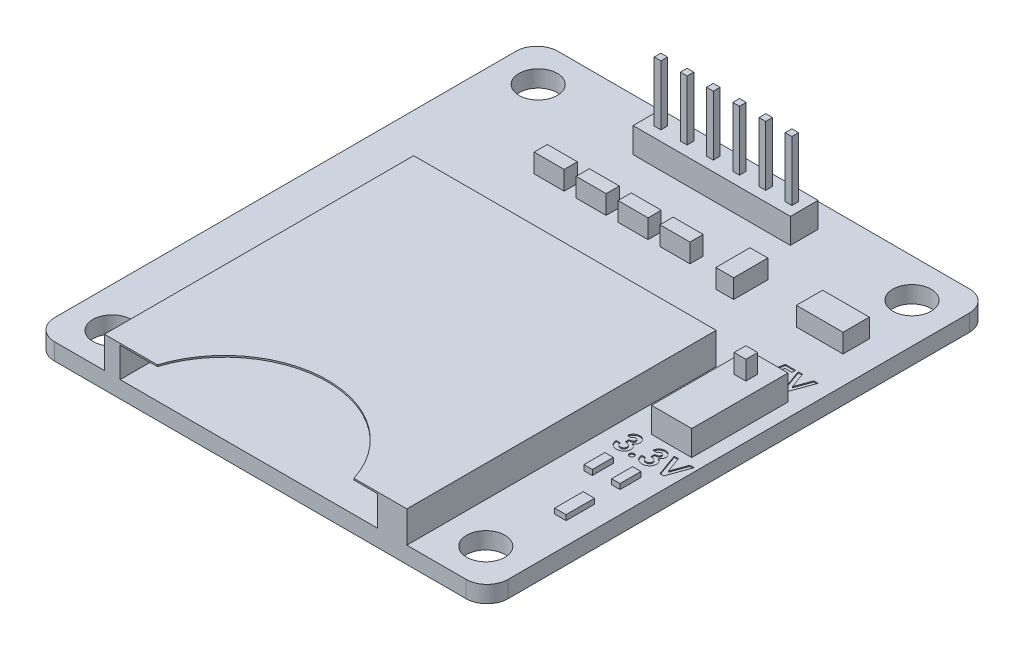
from build123d import *

# Parameters (mm, degrees)
SKETCH1_W                 = 43.25
SKETCH1_H                 = 48
SKETCH1_R                 = 1.825
BOSS_EXTRUDE1_DEPTH       = 1.6
BOSS_EXTRUDE2_DEPTH       = 3
SKETCH3_W                 = 24.55
SKETCH3_H                 = 2.85
CUT_EXTRUDE1_DEPTH        = 21.6
SKETCH4_W                 = 2.86
SKETCH4_H                 = 1.26
SKETCH4_W_2               = 1.7
SKETCH4_H_2               = 3.26
SKETCH4_W_3               = 4.45
SKETCH4_H_3               = 2.5
BOSS_EXTRUDE3_DEPTH       = 1.8
SKETCH4_3_W               = 1.083668594
SKETCH4_3_H               = 2.715833983
SALIENTE_EXTRUIR1_DEPTH   = 0.5
SKETCH4_3_W_2             = 0.8
SKETCH4_3_H_2             = 2
SALIENTE_EXTRUIR1_2_DEPTH = 0.5
SALIENTE_EXTRUIR1_3_DEPTH = 0.5
SKETCH5_W                 = 15
SKETCH5_H                 = 2.65
SKETCH5_W_2               = 3.84
SKETCH5_H_2               = 9.18
BOSS_EXTRUDE4_DEPTH       = 2.4
SKETCH6_W                 = 0.64
SKETCH6_H                 = 0.64
BOSS_EXTRUDE5_DEPTH       = 5.7
SKETCH7_W                 = 1.124823536
SKETCH7_H                 = 1.124823536
BOSS_EXTRUDE6_DEPTH       = 1.8
FILLET1_R                 = 2
CORTAR_EXTRUIR1_DEPTH     = 0.1
CORTAR_EXTRUIR2_DEPTH     = 0.1


with BuildPart() as part:
    # Sketch1 → Boss-Extrude1 (new body)
    with BuildSketch(Plane(origin=(0, 0, 0), x_dir=(1, 0, 0), z_dir=(0, 1, 0))):
        with Locations((21.625, 24)):
            Rectangle(SKETCH1_W, SKETCH1_H)
        with Locations(Location((3.8, 44.325, 0), (0, 0, 270))):
            Circle(SKETCH1_R, mode=Mode.SUBTRACT)
        with Locations(Location((3.8, 3.675, 0), (0, 0, 270))):
            Circle(SKETCH1_R, mode=Mode.SUBTRACT)
        with Locations(Location((39.45, 44.325, 0), (0, 0, 270))):
            Circle(SKETCH1_R, mode=Mode.SUBTRACT)
        with Locations(Location((39.45, 3.675, 0), (0, 0, 270))):
            Circle(SKETCH1_R, mode=Mode.SUBTRACT)
    extrude(amount=BOSS_EXTRUDE1_DEPTH)

    # Sketch2 → Boss-Extrude2 (add)
    with BuildSketch(Plane(origin=(0, 1.6, 0), x_dir=(1, 0, 0), z_dir=(0, 1, 0))):
        with BuildLine():
            Line((6.75, 0), (11.8, 0))
            ThreePointArc((11.8, 0), (21.175, 6.86), (30.55, 0))
            Line((30.55, 0), (35.6, 0))
            Line((35.6, 0), (35.6, 29.5))
            Line((35.6, 29.5), (6.75, 29.5))
            Line((6.75, 29.5), (6.75, 0))
        make_face()
    extrude(amount=BOSS_EXTRUDE2_DEPTH)

    # Sketch3 → Cut-Extrude1 (cut)
    with BuildSketch(Plane.XY):
        with Locations((20.525, 3.025)):
            Rectangle(SKETCH3_W, SKETCH3_H)
    extrude(amount=-CUT_EXTRUDE1_DEPTH, mode=Mode.SUBTRACT)

    # Sketch4 → Boss-Extrude3 (add)
    with BuildSketch(Plane(origin=(0, 1.6, 0), x_dir=(1, 0, 0), z_dir=(0, 1, 0))):
        with Locations((12.43, 37.37)):
            Rectangle(SKETCH4_W, SKETCH4_H)
        with Locations((16.43, 37.37)):
            Rectangle(SKETCH4_W, SKETCH4_H)
        with Locations((20.43, 37.37)):
            Rectangle(SKETCH4_W, SKETCH4_H)
        with Locations((24.43, 37.37)):
            Rectangle(SKETCH4_W, SKETCH4_H)
        with Locations((30.042643512, 37.503476501)):
            Rectangle(SKETCH4_W_2, SKETCH4_H_2)
        with Locations((38.38701225, 37.841656457)):
            Rectangle(SKETCH4_W_3, SKETCH4_H_3)
    extrude(amount=BOSS_EXTRUDE3_DEPTH)

    # Sketch5 → Boss-Extrude4 (add)
    with BuildSketch(Plane(origin=(0, 1.6, 0), x_dir=(1, 0, 0), z_dir=(0, 1, 0))):
        with Locations((21.625, 44.375)):
            Rectangle(SKETCH5_W, SKETCH5_H)
        with Locations((40.03, 25.41)):
            Rectangle(SKETCH5_W_2, SKETCH5_H_2)
    extrude(amount=BOSS_EXTRUDE4_DEPTH)

    # Sketch6 → Boss-Extrude5 (add)
    with BuildSketch(Plane(origin=(0, 4, 0), x_dir=(1, 0, 0), z_dir=(0, 1, 0))):
        with Locations((15.485, 44.34)):
            Rectangle(SKETCH6_W, SKETCH6_H)
        with Locations((17.985, 44.34)):
            Rectangle(SKETCH6_W, SKETCH6_H)
        with Locations((20.485, 44.34)):
            Rectangle(SKETCH6_W, SKETCH6_H)
        with Locations((22.985, 44.34)):
            Rectangle(SKETCH6_W, SKETCH6_H)
        with Locations((25.485, 44.34)):
            Rectangle(SKETCH6_W, SKETCH6_H)
        with Locations((27.985, 44.34)):
            Rectangle(SKETCH6_W, SKETCH6_H)
    extrude(amount=BOSS_EXTRUDE5_DEPTH)

    # Sketch7 → Boss-Extrude6 (add)
    with BuildSketch(Plane(origin=(0, 4, 0), x_dir=(1, 0, 0), z_dir=(0, 1, 0))):
        with Locations((40.050520736, 27.882411768)):
            Rectangle(SKETCH7_W, SKETCH7_H)
    extrude(amount=BOSS_EXTRUDE6_DEPTH)

    # Fillet1
    fillet1_edges = [part.edges().sort_by_distance(p)[0] for p in [
        (0, 0.8, 0),
        (43.25, 0.8, 0),
        (43.25, 0.8, -48),
        (0, 0.8, -48),
    ]]
    fillet(fillet1_edges, radius=FILLET1_R)

    # Croquis1 → Cortar-Extruir1 (cut)
    with BuildSketch(Plane(origin=(0, 1.6, 0), x_dir=(1, 0, 0), z_dir=(0, 1, 0))):
        with BuildLine():
            Line((38.71891942, 32.985440886), (39.682698133, 32.985440886))
            Line((39.682698133, 32.985440886), (39.682698133, 32.632663108))
            Line((39.682698133, 32.632663108), (39.019967764, 32.632663108))
            Line((39.019967764, 32.632663108), (38.937285472, 32.232396014))
            add(Edge.make_bspline(
                [(38.937285472, 32.232396014), (38.948552118, 32.235533917), (38.970772259, 32.241722507), (39.004246928, 32.247928879), (39.036688547, 32.251951652), (39.05797654, 32.252488237), (39.068305104, 32.252748578)],
                knots=[0, 0, 0, 0, 1.05461699, 2.079921384, 3.068411212, 4, 4, 4, 4], degree=3))
            add(Edge.make_bspline(
                [(39.068305104, 32.252748578), (39.090812127, 32.252232843), (39.135178428, 32.251216215), (39.200080697, 32.241565098), (39.262228453, 32.226364882), (39.321431518, 32.204686238), (39.377632058, 32.176470923), (39.4308982, 32.1423383), (39.481295318, 32.102228422), (39.527928147, 32.056116175), (39.570776339, 32.005483884), (39.608030398, 31.950719704), (39.639847689, 31.892604519), (39.665154063, 31.830777086), (39.68512801, 31.765625722), (39.69956163, 31.697108677), (39.708096951, 31.625144749), (39.709247887, 31.576048906), (39.709834885, 31.551009128)],
                knots=[0, 0, 0, 0, 1.01440847, 1.999622559, 2.951875003, 3.895578053, 4.836219714, 5.782137149, 6.743708247, 7.735272588, 8.734977101, 9.730283169, 10.717124674, 11.717316708, 12.737475749, 13.78628267, 14.87096371, 16, 16, 16, 16], degree=3))
            add(Edge.make_bspline(
                [(39.709834885, 31.551009128), (39.709117564, 31.525685092), (39.707702079, 31.475713365), (39.698467339, 31.40223725), (39.682167858, 31.331863719), (39.65977889, 31.264404385), (39.630282857, 31.200355056), (39.594809841, 31.139052231), (39.552760089, 31.080950939), (39.504546252, 31.02664679), (39.452131486, 30.977011755), (39.396322134, 30.93334772), (39.337510273, 30.896604788), (39.275694483, 30.866910288), (39.211229422, 30.843416527), (39.144095523, 30.826314191), (39.073966525, 30.816506952), (39.026358047, 30.815176809), (39.002159271, 30.814500715)],
                knots=[0, 0, 0, 0, 1.06808661, 2.107647099, 3.116961351, 4.110378221, 5.100014249, 6.085620622, 7.093190682, 8.119403071, 9.144090782, 10.133780668, 11.103064255, 12.062861538, 13.020824475, 13.992378307, 14.979551724, 16, 16, 16, 16], degree=3))
            add(Edge.make_bspline(
                [(39.002159271, 30.814500715), (38.980519025, 30.815053802), (38.937839931, 30.816144606), (38.874975501, 30.822849261), (38.814367208, 30.834703154), (38.756336819, 30.851858806), (38.700273754, 30.872973498), (38.646826121, 30.89938141), (38.595700214, 30.930579701), (38.547041212, 30.965999), (38.501639755, 31.005897467), (38.460202116, 31.049573213), (38.422477426, 31.096475727), (38.389272934, 31.147183644), (38.360692727, 31.201622045), (38.335347216, 31.259149362), (38.314601662, 31.320366362), (38.30407389, 31.362805388), (38.298723774, 31.38437251)],
                knots=[0, 0, 0, 0, 1.054957082, 2.080596141, 3.077793124, 4.061112343, 5.027190972, 5.994718051, 6.962465889, 7.943658696, 8.924948258, 9.904494768, 10.875059, 11.855380583, 12.854004648, 13.869083016, 14.917087635, 16, 16, 16, 16], degree=3))
            Line((38.298723774, 31.38437251), (38.732911808, 31.38437251))
            add(Edge.make_bspline(
                [(38.732911808, 31.38437251), (38.740848776, 31.369427373), (38.756273367, 31.340383204), (38.785614349, 31.301822707), (38.818459716, 31.268939971), (38.854513184, 31.241413726), (38.894008358, 31.220791531), (38.935335884, 31.205152613), (38.979014942, 31.196115461), (39.008762309, 31.194985728), (39.02378387, 31.194415245)],
                knots=[0, 0, 0, 0, 1.104910296, 2.147267069, 3.153527244, 4.136738762, 5.099945312, 6.05603338, 7.018353, 8, 8, 8, 8], degree=3))
            add(Edge.make_bspline(
                [(39.02378387, 31.194415245), (39.034253697, 31.194809168), (39.054853257, 31.195584219), (39.085203451, 31.199684432), (39.114174046, 31.207450144), (39.141980429, 31.218203849), (39.168697296, 31.231614934), (39.193941652, 31.248545554), (39.218152702, 31.268033327), (39.240961857, 31.290395611), (39.261620377, 31.315324357), (39.279735639, 31.342111994), (39.295933181, 31.370163294), (39.307930949, 31.400589441), (39.317756105, 31.432481899), (39.324991748, 31.466081242), (39.329315861, 31.501426711), (39.329716158, 31.525556073), (39.329920355, 31.537864764)],
                knots=[0, 0, 0, 0, 0.978869489, 1.925942215, 2.855067702, 3.774946051, 4.70828698, 5.642468714, 6.60995405, 7.609372294, 8.622401667, 9.629904756, 10.629323, 11.642352373, 12.678539694, 13.745912462, 14.850161547, 16, 16, 16, 16], degree=3))
            add(Edge.make_bspline(
                [(39.329920355, 31.537864764), (39.329683361, 31.549887743), (39.329222047, 31.573290762), (39.325405964, 31.607654778), (39.318579064, 31.64026001), (39.309277356, 31.67135619), (39.297370058, 31.700754486), (39.282818544, 31.728629892), (39.265560648, 31.754841508), (39.245503717, 31.778855691), (39.224115212, 31.800882182), (39.201137085, 31.820146376), (39.176776357, 31.83613432), (39.151790006, 31.850092259), (39.125180669, 31.860250544), (39.097546682, 31.867246179), (39.068917106, 31.872379295), (39.049389494, 31.872680885), (39.039472305, 31.872834048)],
                knots=[0, 0, 0, 0, 1.166249705, 2.270133367, 3.348514167, 4.393962215, 5.415026464, 6.420877785, 7.440098956, 8.453121383, 9.451844239, 10.415694839, 11.355045125, 12.27538808, 13.187007209, 14.108269027, 15.039275622, 16, 16, 16, 16], degree=3))
            add(Edge.make_bspline(
                [(39.039472305, 31.872834048), (39.028699933, 31.872425296), (39.007109788, 31.87160607), (38.975032237, 31.864940247), (38.943341452, 31.854152444), (38.9118612, 31.83926896), (38.880903976, 31.819791176), (38.849652805, 31.796945968), (38.81915373, 31.769073416), (38.79976157, 31.748313876), (38.789729383, 31.737574299)],
                knots=[0, 0, 0, 0, 0.88288272, 1.769486374, 2.674910571, 3.623812639, 4.617874466, 5.670434592, 6.794841017, 8, 8, 8, 8], degree=3))
            Line((38.789729383, 31.737574299), (38.470024522, 31.810928332))
            Line((38.470024522, 31.810928332), (38.71891942, 32.985440886))
        make_face()
        Polygon((39.940497278, 32.985440886), (40.346276525, 32.985440886), (40.890283603, 31.481895213), (41.435562716, 32.985440886), (41.840069928, 32.985440886), (41.072608656, 30.868774219), (40.706686514, 30.868774219), align=None)
    extrude(amount=-CORTAR_EXTRUIR1_DEPTH, mode=Mode.SUBTRACT)

    # Croquis2 → Cortar-Extruir2 (cut)
    with BuildSketch(Plane(origin=(0, 1.6, 0), x_dir=(1, 0, 0), z_dir=(0, 1, 0))):
        with BuildLine():
            Line((37.428117875, 19.578143636), (37.048203345, 19.578143636))
            add(Edge.make_bspline(
                [(37.048203345, 19.578143636), (37.050885686, 19.597134208), (37.056144238, 19.634363967), (37.06872725, 19.688263383), (37.08377789, 19.739390667), (37.102567844, 19.787583911), (37.124605405, 19.832928962), (37.149666473, 19.875581423), (37.178021968, 19.91535822), (37.199756756, 19.939319921), (37.210599846, 19.951273978)],
                knots=[0, 0, 0, 0, 1.111473889, 2.178970933, 3.205615836, 4.199322666, 5.174200091, 6.12565194, 7.064921805, 8, 8, 8, 8], degree=3))
            add(Edge.make_bspline(
                [(37.210599846, 19.951273978), (37.226239568, 19.96704649), (37.257063815, 19.998132454), (37.308574748, 20.037950141), (37.362567719, 20.07240964), (37.420125579, 20.09972938), (37.480352687, 20.121841545), (37.543727988, 20.136694336), (37.609992508, 20.146549295), (37.655209706, 20.147520042), (37.678284809, 20.148015431)],
                knots=[0, 0, 0, 0, 1.01925491, 2.00884431, 2.983262333, 3.955970413, 4.92937149, 5.924503185, 6.940838805, 8, 8, 8, 8], degree=3))
            add(Edge.make_bspline(
                [(37.678284809, 20.148015431), (37.698799763, 20.147531113), (37.739128027, 20.146579042), (37.798400429, 20.13893633), (37.854911705, 20.125531865), (37.909259193, 20.108005827), (37.960643621, 20.084158723), (38.010199092, 20.056477312), (38.056541025, 20.02252491), (38.099777851, 19.984162114), (38.139499122, 19.942668993), (38.173897917, 19.89831626), (38.203471178, 19.852288678), (38.227835634, 19.804203844), (38.246568589, 19.753980393), (38.259569816, 19.70190846), (38.268079434, 19.648102945), (38.268927214, 19.611532061), (38.269357191, 19.592984048)],
                knots=[0, 0, 0, 0, 1.091422571, 2.145516843, 3.172569842, 4.178562979, 5.178154469, 6.181868002, 7.194278174, 8.227918432, 9.254613415, 10.245994977, 11.209837596, 12.161663635, 13.10878368, 14.055455738, 15.013766427, 16, 16, 16, 16], degree=3))
            add(Edge.make_bspline(
                [(38.269357191, 19.592984048), (38.268474853, 19.570013877), (38.266737799, 19.524792674), (38.252484018, 19.458608083), (38.230172973, 19.395323803), (38.197942499, 19.335825276), (38.157646198, 19.280274424), (38.108203986, 19.230528478), (38.051024106, 19.18580749), (38.008098409, 19.161774426), (37.986117341, 19.149467755)],
                knots=[0, 0, 0, 0, 0.992805628, 1.954529043, 2.915727527, 3.886831945, 4.871318353, 5.87440735, 6.911542536, 8, 8, 8, 8], degree=3))
            add(Edge.make_bspline(
                [(37.986117341, 19.149467755), (38.001204809, 19.144514222), (38.030851006, 19.134780751), (38.072989511, 19.11561079), (38.113058414, 19.094661201), (38.150367743, 19.070323301), (38.185288585, 19.043581206), (38.217608057, 19.014206316), (38.247519262, 18.982262682), (38.274533911, 18.947574626), (38.298510467, 18.910696915), (38.320023354, 18.872481404), (38.337729659, 18.832348546), (38.352729104, 18.790756687), (38.364148828, 18.74733202), (38.372189333, 18.702242813), (38.376836943, 18.655591916), (38.377545783, 18.623985962), (38.3779042, 18.608004747)],
                knots=[0, 0, 0, 0, 1.059543567, 2.081955587, 3.086750234, 4.076226789, 5.052108497, 6.020845489, 6.989030705, 7.970690546, 8.952259656, 9.923888338, 10.895517021, 11.877585046, 12.873342345, 13.889638361, 14.932918083, 16, 16, 16, 16], degree=3))
            add(Edge.make_bspline(
                [(38.3779042, 18.608004747), (38.37717764, 18.584518851), (38.375745012, 18.538209445), (38.366637032, 18.470000431), (38.349679613, 18.404969195), (38.327371191, 18.342367456), (38.297614176, 18.28300338), (38.262595172, 18.225514641), (38.21954978, 18.171894934), (38.171712218, 18.120726692), (38.118585817, 18.074206818), (38.060988155, 18.033876181), (38.000185756, 17.999265318), (37.935793941, 17.971167233), (37.867835079, 17.949528495), (37.796460646, 17.933887017), (37.721370746, 17.924317302), (37.670116014, 17.923314099), (37.643939857, 17.922801756)],
                knots=[0, 0, 0, 0, 1.005138573, 1.981928558, 2.936866704, 3.876260664, 4.820238198, 5.773547, 6.751179199, 7.756627054, 8.768222608, 9.766606018, 10.760583154, 11.757261445, 12.767156078, 13.807575856, 14.880313354, 16, 16, 16, 16], degree=3))
            add(Edge.make_bspline(
                [(37.643939857, 17.922801756), (37.619177635, 17.923341935), (37.570758385, 17.924398184), (37.4999351, 17.933540552), (37.432624271, 17.948287933), (37.36865412, 17.96907559), (37.308272143, 17.996033628), (37.250930772, 18.028134603), (37.197774241, 18.067230024), (37.148210283, 18.11155505), (37.103338376, 18.161285213), (37.063233458, 18.215268537), (37.028779849, 18.2737103), (36.999836256, 18.336360813), (36.976628951, 18.403329986), (36.958323097, 18.474481631), (36.945536159, 18.549954759), (36.94164187, 18.601881876), (36.939656337, 18.628357312)],
                knots=[0, 0, 0, 0, 1.066544725, 2.085487077, 3.070979577, 4.031932826, 4.977951092, 5.916076795, 6.857635327, 7.814973522, 8.776389752, 9.738577119, 10.707772778, 11.69409279, 12.707140348, 13.757286496, 14.856535458, 16, 16, 16, 16], degree=3))
            Line((36.939656337, 18.628357312), (37.319570867, 18.628357312))
            add(Edge.make_bspline(
                [(37.319570867, 18.628357312), (37.321978345, 18.615045115), (37.326667542, 18.589116121), (37.335813531, 18.551576702), (37.347732032, 18.516925499), (37.361512784, 18.484854534), (37.376398071, 18.454942727), (37.394383057, 18.428294793), (37.414149897, 18.404187133), (37.442673591, 18.375527681), (37.483450176, 18.346081291), (37.538512076, 18.320490977), (37.599763225, 18.305491908), (37.642583886, 18.303662068), (37.664716433, 18.302716286)],
                knots=[0, 0, 0, 0, 0.928156231, 1.807827665, 2.648129825, 3.438902246, 4.202261636, 4.936546065, 5.639352463, 6.338805438, 7.70633318, 9.064371875, 10.482673459, 12, 12, 12, 12], degree=3))
            add(Edge.make_bspline(
                [(37.664716433, 18.302716286), (37.676460744, 18.302917681), (37.699465223, 18.30331217), (37.733255378, 18.307684548), (37.765445257, 18.314885858), (37.796094817, 18.324672171), (37.825399175, 18.336939926), (37.852798442, 18.352758462), (37.878851083, 18.371149769), (37.903273881, 18.39182648), (37.925841051, 18.414356694), (37.944618263, 18.439305077), (37.961779276, 18.464657094), (37.974471685, 18.492071362), (37.98559297, 18.520072702), (37.992399764, 18.549677473), (37.997539383, 18.580264647), (37.997838077, 18.601197167), (37.99798967, 18.611820853)],
                knots=[0, 0, 0, 0, 1.110435564, 2.175094844, 3.216326037, 4.226890168, 5.215276772, 6.21526065, 7.213097102, 8.228249917, 9.239874822, 10.221364777, 11.178138315, 12.128914389, 13.072518965, 14.022636769, 14.996447288, 16, 16, 16, 16], degree=3))
            add(Edge.make_bspline(
                [(37.99798967, 18.611820853), (37.997587218, 18.623439664), (37.996786028, 18.646570055), (37.990240224, 18.680323996), (37.979903014, 18.712792567), (37.965543368, 18.743831981), (37.946367661, 18.773327835), (37.923740541, 18.801871903), (37.895879364, 18.827978518), (37.865311922, 18.853784115), (37.829865698, 18.876278813), (37.791266972, 18.897038115), (37.74850131, 18.91355611), (37.702612661, 18.928309739), (37.652732997, 18.93908556), (37.599172052, 18.946909857), (37.542016229, 18.952733833), (37.502617977, 18.953569378), (37.482391379, 18.953998337)],
                knots=[0, 0, 0, 0, 0.809814727, 1.612155564, 2.388397, 3.182215007, 3.988903953, 4.837162975, 5.715530372, 6.646997145, 7.623086902, 8.637258368, 9.698941581, 10.815059213, 11.996518529, 13.252603015, 14.589518788, 16, 16, 16, 16], degree=3))
            Line((37.482391379, 18.953998337), (37.482391379, 19.306776115))
            add(Edge.make_bspline(
                [(37.482391379, 19.306776115), (37.507574697, 19.308920807), (37.554687696, 19.312933101), (37.620083065, 19.322315989), (37.675137536, 19.334857764), (37.721174344, 19.349988737), (37.759400359, 19.369420849), (37.792794395, 19.390873041), (37.821554919, 19.415786628), (37.845861419, 19.443418689), (37.865305864, 19.473092932), (37.879067508, 19.50434813), (37.88815498, 19.536217209), (37.889016017, 19.558014699), (37.889442662, 19.568815378)],
                knots=[0, 0, 0, 0, 1.70044513, 3.18119609, 4.440695891, 5.496282586, 6.431922213, 7.318171381, 8.16090191, 8.983045123, 9.787564368, 10.536848927, 11.275007137, 12, 12, 12, 12], degree=3))
            add(Edge.make_bspline(
                [(37.889442662, 19.568815378), (37.888706577, 19.582595871), (37.887269896, 19.609492476), (37.876111853, 19.647987185), (37.856742755, 19.682302026), (37.830772195, 19.712364794), (37.799126165, 19.73747547), (37.76203147, 19.755705393), (37.720293068, 19.766416287), (37.690927853, 19.767526645), (37.675740738, 19.768100901)],
                knots=[0, 0, 0, 0, 1.009664648, 1.970651636, 2.907870547, 3.878035693, 4.867062054, 5.849714035, 6.887914197, 8, 8, 8, 8], degree=3))
            add(Edge.make_bspline(
                [(37.675740738, 19.768100901), (37.661975327, 19.76742334), (37.634660534, 19.76607885), (37.594718131, 19.756043937), (37.556786156, 19.739151409), (37.521650073, 19.715857608), (37.489817078, 19.687882741), (37.463691373, 19.654752318), (37.44196125, 19.61845124), (37.432750423, 19.591632176), (37.428117875, 19.578143636)],
                knots=[0, 0, 0, 0, 0.98818071, 1.960853194, 2.938124878, 3.957524365, 4.978590984, 5.968022688, 6.978025184, 8, 8, 8, 8], degree=3))
        make_face()
        with BuildLine():
            add(Edge.make_bspline(
                [(38.879934115, 18.411263294), (38.895270814, 18.41042242), (38.925466125, 18.408766884), (38.969094234, 18.396411789), (39.008468853, 18.3742141), (39.043675024, 18.345261063), (39.073444475, 18.310426694), (39.094961161, 18.270702355), (39.108360141, 18.227242352), (39.109839398, 18.196952042), (39.110596508, 18.181448925)],
                knots=[0, 0, 0, 0, 1.016957001, 2.002212695, 2.9757545, 3.99499976, 5.013036768, 5.994806404, 6.97370641, 8, 8, 8, 8], degree=3))
            add(Edge.make_bspline(
                [(39.110596508, 18.181448925), (39.109844358, 18.165943318), (39.108374791, 18.135648143), (39.094868441, 18.092103455), (39.073476628, 18.052052618), (39.043672635, 18.016844976), (39.008614654, 17.987346292), (38.969003705, 17.965353298), (38.925549236, 17.95229733), (38.895285442, 17.950732347), (38.879934115, 17.949938508)],
                knots=[0, 0, 0, 0, 1.023218912, 1.999186227, 2.986238111, 4.008388923, 5.030539734, 6.0011649, 6.986089706, 8, 8, 8, 8], degree=3))
            add(Edge.make_bspline(
                [(38.879934115, 17.949938508), (38.86457915, 17.950725892), (38.834308184, 17.952278149), (38.790786169, 17.965463347), (38.750882781, 17.987199458), (38.715815991, 18.016880758), (38.685878848, 18.051927945), (38.665095223, 18.092229823), (38.651463065, 18.135631726), (38.650013589, 18.16593776), (38.649271721, 18.181448925)],
                knots=[0, 0, 0, 0, 1.013427518, 1.99788335, 2.976245624, 3.997909735, 5.019573847, 6.001765691, 6.977268297, 8, 8, 8, 8], degree=3))
            add(Edge.make_bspline(
                [(38.649271721, 18.181448925), (38.650018483, 18.196957696), (38.651477522, 18.227259054), (38.665002768, 18.270574532), (38.685912157, 18.310552045), (38.715813495, 18.345225207), (38.751029333, 18.374359788), (38.790695132, 18.396303248), (38.834391253, 18.408786207), (38.864593761, 18.410428929), (38.879934115, 18.411263294)],
                knots=[0, 0, 0, 0, 1.025808215, 2.00424526, 2.981110158, 3.998665696, 5.017428914, 5.998734231, 6.983523959, 8, 8, 8, 8], degree=3))
        make_face()
        with BuildLine():
            Line((39.870425568, 19.578143636), (39.490511038, 19.578143636))
            add(Edge.make_bspline(
                [(39.490511038, 19.578143636), (39.493193379, 19.597134208), (39.498451931, 19.634363967), (39.511034942, 19.688263383), (39.526085582, 19.739390667), (39.544875537, 19.787583911), (39.566913097, 19.832928962), (39.591974165, 19.875581423), (39.62032966, 19.91535822), (39.642064448, 19.939319921), (39.652907539, 19.951273978)],
                knots=[0, 0, 0, 0, 1.111473889, 2.178970933, 3.205615836, 4.199322666, 5.174200091, 6.12565194, 7.064921805, 8, 8, 8, 8], degree=3))
            add(Edge.make_bspline(
                [(39.652907539, 19.951273978), (39.66854726, 19.96704649), (39.699371508, 19.998132454), (39.750882441, 20.037950141), (39.804875411, 20.07240964), (39.862433272, 20.09972938), (39.922660379, 20.121841545), (39.98603568, 20.136694336), (40.0523002, 20.146549295), (40.097517399, 20.147520042), (40.120592501, 20.148015431)],
                knots=[0, 0, 0, 0, 1.01925491, 2.00884431, 2.983262333, 3.955970413, 4.92937149, 5.924503185, 6.940838805, 8, 8, 8, 8], degree=3))
            add(Edge.make_bspline(
                [(40.120592501, 20.148015431), (40.141107455, 20.147531113), (40.18143572, 20.146579042), (40.240708122, 20.13893633), (40.297219397, 20.125531865), (40.351566886, 20.108005827), (40.402951313, 20.084158723), (40.452506785, 20.056477312), (40.498848718, 20.02252491), (40.542085544, 19.984162114), (40.581806815, 19.942668993), (40.616205609, 19.89831626), (40.64577887, 19.852288678), (40.670143326, 19.804203844), (40.688876281, 19.753980393), (40.701877508, 19.70190846), (40.710387126, 19.648102945), (40.711234907, 19.611532061), (40.711664884, 19.592984048)],
                knots=[0, 0, 0, 0, 1.091422571, 2.145516843, 3.172569842, 4.178562979, 5.178154469, 6.181868002, 7.194278174, 8.227918432, 9.254613415, 10.245994977, 11.209837596, 12.161663635, 13.10878368, 14.055455738, 15.013766427, 16, 16, 16, 16], degree=3))
            add(Edge.make_bspline(
                [(40.711664884, 19.592984048), (40.710782545, 19.570013877), (40.709045492, 19.524792674), (40.69479171, 19.458608083), (40.672480665, 19.395323803), (40.640250192, 19.335825276), (40.599953891, 19.280274424), (40.550511679, 19.230528478), (40.493331799, 19.18580749), (40.450406101, 19.161774426), (40.428425033, 19.149467755)],
                knots=[0, 0, 0, 0, 0.992805628, 1.954529043, 2.915727527, 3.886831945, 4.871318353, 5.87440735, 6.911542536, 8, 8, 8, 8], degree=3))
            add(Edge.make_bspline(
                [(40.428425033, 19.149467755), (40.443512501, 19.144514222), (40.473158698, 19.134780751), (40.515297203, 19.11561079), (40.555366106, 19.094661201), (40.592675435, 19.070323301), (40.627596277, 19.043581206), (40.65991575, 19.014206316), (40.689826954, 18.982262682), (40.716841603, 18.947574626), (40.740818159, 18.910696915), (40.762331046, 18.872481404), (40.780037352, 18.832348546), (40.795036796, 18.790756687), (40.80645652, 18.74733202), (40.814497026, 18.702242813), (40.819144635, 18.655591916), (40.819853475, 18.623985962), (40.820211892, 18.608004747)],
                knots=[0, 0, 0, 0, 1.059543567, 2.081955587, 3.086750234, 4.076226789, 5.052108497, 6.020845489, 6.989030705, 7.970690546, 8.952259656, 9.923888338, 10.895517021, 11.877585046, 12.873342345, 13.889638361, 14.932918083, 16, 16, 16, 16], degree=3))
            add(Edge.make_bspline(
                [(40.820211892, 18.608004747), (40.819485332, 18.584518851), (40.818052704, 18.538209445), (40.808944724, 18.470000431), (40.791987306, 18.404969195), (40.769678883, 18.342367456), (40.739921868, 18.28300338), (40.704902864, 18.225514641), (40.661857472, 18.171894934), (40.614019911, 18.120726692), (40.56089351, 18.074206818), (40.503295848, 18.033876181), (40.442493449, 17.999265318), (40.378101633, 17.971167233), (40.310142771, 17.949528495), (40.238768338, 17.933887017), (40.163678438, 17.924317302), (40.112423706, 17.923314099), (40.086247549, 17.922801756)],
                knots=[0, 0, 0, 0, 1.005138573, 1.981928558, 2.936866704, 3.876260664, 4.820238198, 5.773547, 6.751179199, 7.756627054, 8.768222608, 9.766606018, 10.760583154, 11.757261445, 12.767156078, 13.807575856, 14.880313354, 16, 16, 16, 16], degree=3))
            add(Edge.make_bspline(
                [(40.086247549, 17.922801756), (40.061485327, 17.923341935), (40.013066078, 17.924398184), (39.942242792, 17.933540552), (39.874931963, 17.948287933), (39.810961812, 17.96907559), (39.750579835, 17.996033628), (39.693238464, 18.028134603), (39.640081934, 18.067230024), (39.590517976, 18.11155505), (39.545646068, 18.161285213), (39.50554115, 18.215268537), (39.471087542, 18.2737103), (39.442143948, 18.336360813), (39.418936643, 18.403329986), (39.400630789, 18.474481631), (39.387843851, 18.549954759), (39.383949562, 18.601881876), (39.381964029, 18.628357312)],
                knots=[0, 0, 0, 0, 1.066544725, 2.085487077, 3.070979577, 4.031932826, 4.977951092, 5.916076795, 6.857635327, 7.814973522, 8.776389752, 9.738577119, 10.707772778, 11.69409279, 12.707140348, 13.757286496, 14.856535458, 16, 16, 16, 16], degree=3))
            Line((39.381964029, 18.628357312), (39.761878559, 18.628357312))
            add(Edge.make_bspline(
                [(39.761878559, 18.628357312), (39.764286038, 18.615045115), (39.768975234, 18.589116121), (39.778121224, 18.551576702), (39.790039724, 18.516925499), (39.803820476, 18.484854534), (39.818705763, 18.454942727), (39.836690749, 18.428294793), (39.856457589, 18.404187133), (39.884981283, 18.375527681), (39.925757869, 18.346081291), (39.980819768, 18.320490977), (40.042070917, 18.305491908), (40.084891579, 18.303662068), (40.107024125, 18.302716286)],
                knots=[0, 0, 0, 0, 0.928156231, 1.807827665, 2.648129825, 3.438902246, 4.202261636, 4.936546065, 5.639352463, 6.338805438, 7.70633318, 9.064371875, 10.482673459, 12, 12, 12, 12], degree=3))
            add(Edge.make_bspline(
                [(40.107024125, 18.302716286), (40.118768437, 18.302917681), (40.141772916, 18.30331217), (40.17556307, 18.307684548), (40.207752949, 18.314885858), (40.23840251, 18.324672171), (40.267706868, 18.336939926), (40.295106134, 18.352758462), (40.321158775, 18.371149769), (40.345581574, 18.39182648), (40.368148743, 18.414356694), (40.386925955, 18.439305077), (40.404086968, 18.464657094), (40.416779377, 18.492071362), (40.427900662, 18.520072702), (40.434707456, 18.549677473), (40.439847075, 18.580264647), (40.440145769, 18.601197167), (40.440297362, 18.611820853)],
                knots=[0, 0, 0, 0, 1.110435564, 2.175094844, 3.216326037, 4.226890168, 5.215276772, 6.21526065, 7.213097102, 8.228249917, 9.239874822, 10.221364777, 11.178138315, 12.128914389, 13.072518965, 14.022636769, 14.996447288, 16, 16, 16, 16], degree=3))
            add(Edge.make_bspline(
                [(40.440297362, 18.611820853), (40.43989491, 18.623439664), (40.439093721, 18.646570055), (40.432547916, 18.680323996), (40.422210707, 18.712792567), (40.407851061, 18.743831981), (40.388675353, 18.773327835), (40.366048233, 18.801871903), (40.338187056, 18.827978518), (40.307619614, 18.853784115), (40.27217339, 18.876278813), (40.233574664, 18.897038115), (40.190809002, 18.91355611), (40.144920353, 18.928309739), (40.095040689, 18.93908556), (40.041479744, 18.946909857), (39.984323921, 18.952733833), (39.94492567, 18.953569378), (39.924699072, 18.953998337)],
                knots=[0, 0, 0, 0, 0.809814727, 1.612155564, 2.388397, 3.182215007, 3.988903953, 4.837162975, 5.715530372, 6.646997145, 7.623086902, 8.637258368, 9.698941581, 10.815059213, 11.996518529, 13.252603015, 14.589518788, 16, 16, 16, 16], degree=3))
            Line((39.924699072, 18.953998337), (39.924699072, 19.306776115))
            add(Edge.make_bspline(
                [(39.924699072, 19.306776115), (39.949882389, 19.308920807), (39.996995388, 19.312933101), (40.062390757, 19.322315989), (40.117445228, 19.334857764), (40.163482036, 19.349988737), (40.201708052, 19.369420849), (40.235102088, 19.390873041), (40.263862611, 19.415786628), (40.288169112, 19.443418689), (40.307613556, 19.473092932), (40.321375201, 19.50434813), (40.330462672, 19.536217209), (40.331323709, 19.558014699), (40.331750354, 19.568815378)],
                knots=[0, 0, 0, 0, 1.70044513, 3.18119609, 4.440695891, 5.496282586, 6.431922213, 7.318171381, 8.16090191, 8.983045123, 9.787564368, 10.536848927, 11.275007137, 12, 12, 12, 12], degree=3))
            add(Edge.make_bspline(
                [(40.331750354, 19.568815378), (40.331014269, 19.582595871), (40.329577588, 19.609492476), (40.318419545, 19.647987185), (40.299050447, 19.682302026), (40.273079888, 19.712364794), (40.241433858, 19.73747547), (40.204339163, 19.755705393), (40.16260076, 19.766416287), (40.133235545, 19.767526645), (40.118048431, 19.768100901)],
                knots=[0, 0, 0, 0, 1.009664648, 1.970651636, 2.907870547, 3.878035693, 4.867062054, 5.849714035, 6.887914197, 8, 8, 8, 8], degree=3))
            add(Edge.make_bspline(
                [(40.118048431, 19.768100901), (40.104283019, 19.76742334), (40.076968226, 19.76607885), (40.037025824, 19.756043937), (39.999093849, 19.739151409), (39.963957765, 19.715857608), (39.93212477, 19.687882741), (39.905999065, 19.654752318), (39.884268942, 19.61845124), (39.875058116, 19.591632176), (39.870425568, 19.578143636)],
                knots=[0, 0, 0, 0, 0.98818071, 1.960853194, 2.938124878, 3.957524365, 4.978590984, 5.968022688, 6.978025184, 8, 8, 8, 8], degree=3))
        make_face()
        Polygon((40.996600781, 20.093741927), (41.402380028, 20.093741927), (41.946387106, 18.590196254), (42.491666219, 20.093741927), (42.896173431, 20.093741927), (42.128712159, 17.97707526), (41.762790017, 17.97707526), align=None)
    extrude(amount=-CORTAR_EXTRUIR2_DEPTH, mode=Mode.SUBTRACT)


with BuildPart() as body_2:
    # Sketch4<3> → Saliente-Extruir1 (new body)
    with BuildSketch(Plane(origin=(0, 1.6, 0), x_dir=(1, 0, 0), z_dir=(0, 1, 0))):
        with Locations((40.627197747, 10.969623977)):
            Rectangle(SKETCH4_3_W, SKETCH4_3_H)
    extrude(amount=SALIENTE_EXTRUIR1_DEPTH)


with BuildPart() as body_3:
    # Sketch4<3> → Saliente-Extruir1 2 (new body)
    with BuildSketch(Plane(origin=(0, 1.6, 0), x_dir=(1, 0, 0), z_dir=(0, 1, 0))):
        with Locations((40.771697043, 15.750470598)):
            Rectangle(SKETCH4_3_W_2, SKETCH4_3_H_2)
    extrude(amount=SALIENTE_EXTRUIR1_2_DEPTH)


with BuildPart() as body_4:
    # Sketch4<3> → Saliente-Extruir1 3 (new body)
    with BuildSketch(Plane(origin=(0, 1.6, 0), x_dir=(1, 0, 0), z_dir=(0, 1, 0))):
        with Locations((38.28864883, 15.595280085)):
            Rectangle(SKETCH4_3_W_2, SKETCH4_3_H_2)
    extrude(amount=SALIENTE_EXTRUIR1_3_DEPTH)


solid = Compound([part.part, body_2.part, body_3.part, body_4.part])
